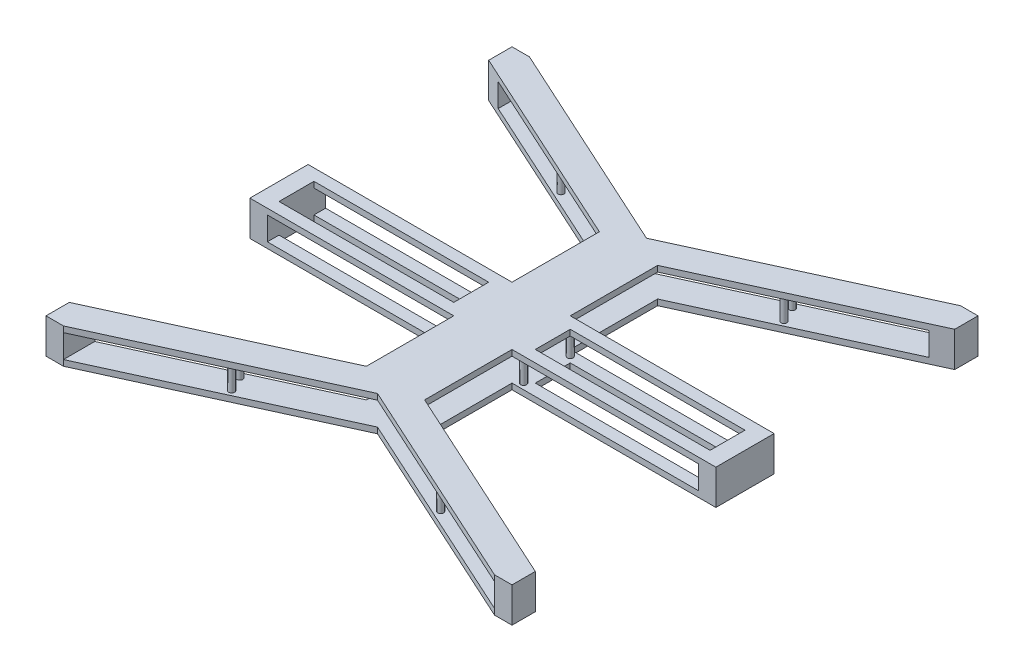
from build123d import *

# Parameters (mm, degrees)
BOSS_EXTRUDE1_DEPTH      = 6
BOSS_EXTRUDE1_DEPTH_BACK = 6
SKETCH2_W                = 148
SKETCH2_H                = 8
CUT_EXTRUDE1_DEPTH       = 160
SKETCH4_W                = 60
SKETCH4_H                = 12
CUT_EXTRUDE2_DEPTH       = 12
SKETCH5_R                = 1
BOSS_EXTRUDE2_DEPTH      = 8


with BuildPart() as part:
    # Sketch1 → Boss-Extrude1 (new, two sides: drawn at the far end of the back side and taken through both)
    with BuildSketch(Plane(origin=(0, 0, 0), x_dir=(1, 0, 0), z_dir=(0, 1, 0)).offset(-BOSS_EXTRUDE1_DEPTH_BACK)):
        Polygon((80, 10), (80, -10), (10, -10), (10, -40), (80, -72), (80, -80), (74, -80), (0, -46.171428571), (-74, -80), (-80, -80), (-80, -72), (-10, -40), (-10, -10), (-80, -10), (-80, 10), (-10, 10), (-10, 40), (-80, 72), (-80, 80), (-74, 80), (0, 46.171428571), (74, 80), (80, 80), (80, 72), (10, 40), (10, 10), align=None)
    extrude(amount=BOSS_EXTRUDE1_DEPTH + BOSS_EXTRUDE1_DEPTH_BACK)

    # Sketch2 → Cut-Extrude1 (cut)
    with BuildSketch(Plane.XY.offset(80)):
        Rectangle(SKETCH2_W, SKETCH2_H)
    extrude(amount=-CUT_EXTRUDE1_DEPTH, mode=Mode.SUBTRACT)

    # Sketch4 → Cut-Extrude2 (cut)
    with BuildSketch(Plane(origin=(0, 6, 0), x_dir=(1, 0, 0), z_dir=(0, 1, 0))):
        with Locations((-44, 0)):
            Rectangle(SKETCH4_W, SKETCH4_H)
        with Locations((44, 0)):
            Rectangle(SKETCH4_W, SKETCH4_H)
    extrude(amount=-CUT_EXTRUDE2_DEPTH, mode=Mode.SUBTRACT)

    # Sketch5 → Boss-Extrude2 (add)
    with BuildSketch(Plane(origin=(0, -4, 0), x_dir=(1, 0, 0), z_dir=(0, 1, 0))):
        with Locations((-35.87258255, -60.371251291)):
            Circle(SKETCH5_R)
        with Locations((-38.271663698, -55.12326128)):
            Circle(SKETCH5_R)
        with Locations((-12, -8)):
            Circle(SKETCH5_R)
        with Locations((0, -40.171428571)):
            Circle(SKETCH5_R)
        with Locations((12, -8)):
            Circle(SKETCH5_R)
        with Locations((35.87258255, -60.371251291)):
            Circle(SKETCH5_R)
        with Locations((38.271663698, -55.12326128)):
            Circle(SKETCH5_R)
        with Locations((38.271663698, 55.12326128)):
            Circle(SKETCH5_R)
        with Locations((35.87258255, 60.371251291)):
            Circle(SKETCH5_R)
        with Locations((-35.87258255, 60.371251291)):
            Circle(SKETCH5_R)
        with Locations((-38.271663698, 55.12326128)):
            Circle(SKETCH5_R)
        with Locations((0, 40.171428571)):
            Circle(SKETCH5_R)
        with Locations((12, 8)):
            Circle(SKETCH5_R)
        with Locations((-12, 8)):
            Circle(SKETCH5_R)
    extrude(amount=BOSS_EXTRUDE2_DEPTH)


solid = part.part
